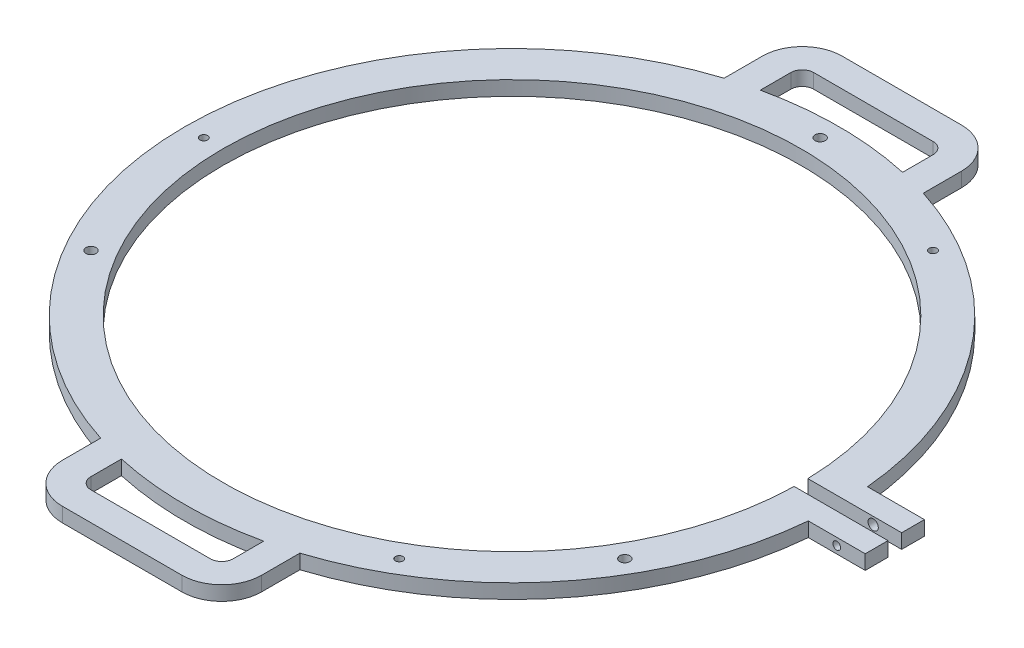
from build123d import *

# Parameters (mm, degrees)
BOSS_EXTRUDE1_DEPTH                          = 12.7
M8X1_25_TAPPED_HOLE1_FOR_LOWERING_D          = 6.8
M8_CLEARANCE_HOLE1_FOR_SPACER_BLOCK_D        = 9
M8_CLEARANCE_HOLE2_FOR_CLAMP_TIGHTENIN_D     = 9
M8_CLEARANCE_HOLE2_FOR_CLAMP_TIGHTENIN_DEPTH = 20
M8X1_25_TAPPED_HOLE2_FOR_CLAMP_TIGHTEN_D     = 6.8
BOSS_EXTRUDE2_START                          = -12.7
BOSS_EXTRUDE2_HANDLES_DEPTH                  = 12.7


with BuildPart() as part:
    # Sketch1 → Boss-Extrude1 (new body)
    with BuildSketch(Plane(origin=(0, 0, 0), x_dir=(1, 0, 0), z_dir=(0, 1, 0))):
        with BuildLine():
            Line((275.144331903, 6), (253.92912397, 6))
            ThreePointArc((253.92912397, 6), (-254, 0), (253.92912397, -6))
            Line((253.92912397, -6), (275.067203981, -6))
            Line((275.067203981, -6), (336.321934193, -6))
            Line((336.321934193, -6), (336.321934193, -26))
            Line((336.321934193, -26), (286.321934193, -26))
            ThreePointArc((286.321934193, -26), (-287.5, 0), (286.321934193, 26))
            Line((286.321934193, 26), (336.321934193, 26))
            Line((336.321934193, 26), (336.321934193, 6))
            Line((336.321934193, 6), (275.144331903, 6))
        make_face()
    extrude(amount=BOSS_EXTRUDE1_DEPTH)

    # M8x1.25 Tapped Hole1 - For Lowering (through all)
    with Locations(Plane(origin=(0, 12.7, 0), x_dir=(1, 0, 0), z_dir=(0, 1, 0))):
        with Locations((135.375, -234.476378075), (-270.75, 0), (135.375, 234.476378075)):
            Hole(M8X1_25_TAPPED_HOLE1_FOR_LOWERING_D / 2)

    # M8 Clearance Hole1 - For Spacer Block (through all)
    with Locations(Plane(origin=(0, 12.7, 0), x_dir=(1, 0, 0), z_dir=(0, 1, 0))):
        with Locations((0, 270.75), (234.476378075, -135.375), (-234.476378075, -135.375)):
            Hole(M8_CLEARANCE_HOLE1_FOR_SPACER_BLOCK_D / 2)

    # M8 Clearance Hole2 - For Clamp Tightening
    with Locations(Plane(origin=(0, 0, -26), x_dir=(-1, 0, 0), z_dir=(0, 0, -1))):
        with Locations((-311.321934193, 6.35)):
            Hole(M8_CLEARANCE_HOLE2_FOR_CLAMP_TIGHTENIN_D / 2, depth=M8_CLEARANCE_HOLE2_FOR_CLAMP_TIGHTENIN_DEPTH)

    # M8x1.25 Tapped Hole2 - For Clamp Tightening (through all)
    with Locations(Plane.XY.offset(26)):
        with Locations((311.321934193, 6.35)):
            Hole(M8X1_25_TAPPED_HOLE2_FOR_CLAMP_TIGHTEN_D / 2)

    # Sketch14 → Boss-Extrude2 - Handles (add)
    with BuildSketch(Plane(origin=(0, 12.7, 0), x_dir=(1, 0, 0), z_dir=(0, 1, 0)).offset(BOSS_EXTRUDE2_START)):
        with BuildLine():
            Line((-52.5, 342.5), (52.5, 342.5))
            ThreePointArc((52.5, 342.5), (77.248737342, 332.248737342), (87.5, 307.5))
            Line((87.5, 307.5), (87.5, 273.861278753))
            ThreePointArc((87.5, 273.861278753), (75.076192149, 277.524441036), (62.5, 280.624304008))
            Line((62.5, 280.624304008), (62.5, 307.5))
            ThreePointArc((62.5, 307.5), (59.571067812, 314.571067812), (52.5, 317.5))
            Line((52.5, 317.5), (-52.5, 317.5))
            ThreePointArc((-52.5, 317.5), (-59.571067812, 314.571067812), (-62.5, 307.5))
            Line((-62.5, 307.5), (-62.5, 280.624304008))
            ThreePointArc((-62.5, 280.624304008), (-75.076192149, 277.524441036), (-87.5, 273.861278753))
            Line((-87.5, 273.861278753), (-87.5, 307.5))
            ThreePointArc((-87.5, 307.5), (-77.248737342, 332.248737342), (-52.5, 342.5))
        make_face()
    boss_extrude2_handles = extrude(amount=BOSS_EXTRUDE2_HANDLES_DEPTH)

    # Mirror1: Boss-Extrude2 - Handles across plane
    add(boss_extrude2_handles.mirror(Plane.XY))


solid = part.part
